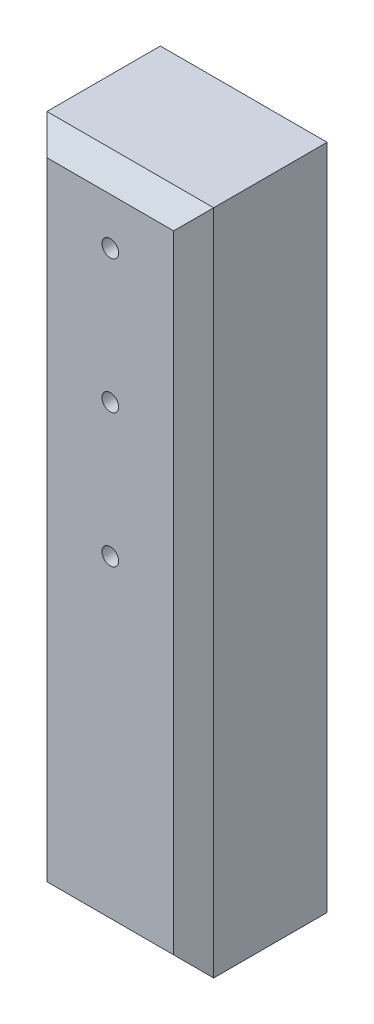
from build123d import *

# Parameters (mm, degrees)
SKETCH1_R           = 1.6
BOSS_EXTRUDE1_DEPTH = 100
SKETCH2_W           = 8.75
SKETCH2_H           = 20
CUT_EXTRUDE1_DEPTH  = 100
SKETCH3_W           = 25
SKETCH3_H           = 20
BOSS_EXTRUDE2_DEPTH = 60
SKETCH4_R           = 1.25
CUT_EXTRUDE2_DEPTH  = 60
CHAMFER1_SIZE       = 3


with BuildPart() as part:
    # Sketch1 → Boss-Extrude1 (new body)
    with BuildSketch(Plane(origin=(0, 0, 0), x_dir=(1, 0, 0), z_dir=(0, 1, 0))):
        Polygon((-17.25, -10), (17.25, -10), (25.25, -10), (25.25, 10), (17.25, 10), (-17.25, 10), align=None)
        with Locations(Location((-5, 5, 0), (0, 0, 270))):
            Circle(SKETCH1_R, mode=Mode.SUBTRACT)
        with Locations(Location((13, 5, 0), (0, 0, 270))):
            Circle(SKETCH1_R, mode=Mode.SUBTRACT)
        with Locations(Location((-5, -5, 0), (0, 0, 270))):
            Circle(SKETCH1_R, mode=Mode.SUBTRACT)
        with Locations(Location((13, -5, 0), (0, 0, 270))):
            Circle(SKETCH1_R, mode=Mode.SUBTRACT)
    extrude(amount=BOSS_EXTRUDE1_DEPTH)

    # Sketch2 → Cut-Extrude1 (cut)
    with BuildSketch(Plane.XZ):
        with Locations((-12.875, 0)):
            Rectangle(SKETCH2_W, SKETCH2_H)
        with Locations((20.875, 0)):
            Rectangle(SKETCH2_W, SKETCH2_H)
    extrude(amount=-CUT_EXTRUDE1_DEPTH, mode=Mode.SUBTRACT)

    # Sketch3 → Boss-Extrude2 (add)
    with BuildSketch(Plane(origin=(0, 100, 0), x_dir=(1, 0, 0), z_dir=(0, 1, 0))):
        with Locations((4, 0)):
            Rectangle(SKETCH3_W, SKETCH3_H)
    extrude(amount=-BOSS_EXTRUDE2_DEPTH)

    # Sketch4 → Cut-Extrude2 (cut)
    with BuildSketch(Plane.XY.offset(10)):
        with Locations((4, 50)):
            Circle(SKETCH4_R)
        with Locations((4, 70)):
            Circle(SKETCH4_R)
        with Locations((4, 90)):
            Circle(SKETCH4_R)
    extrude(amount=-CUT_EXTRUDE2_DEPTH, mode=Mode.SUBTRACT)

    # Chamfer1
    chamfer1_edges = [part.edges().sort_by_distance(p)[0] for p in [
        (4, 0, 10),
        (4, 100, 10),
        (-8.5, 50, 10),
        (16.5, 50, 10),
    ]]
    chamfer(chamfer1_edges, length=CHAMFER1_SIZE)


solid = part.part
